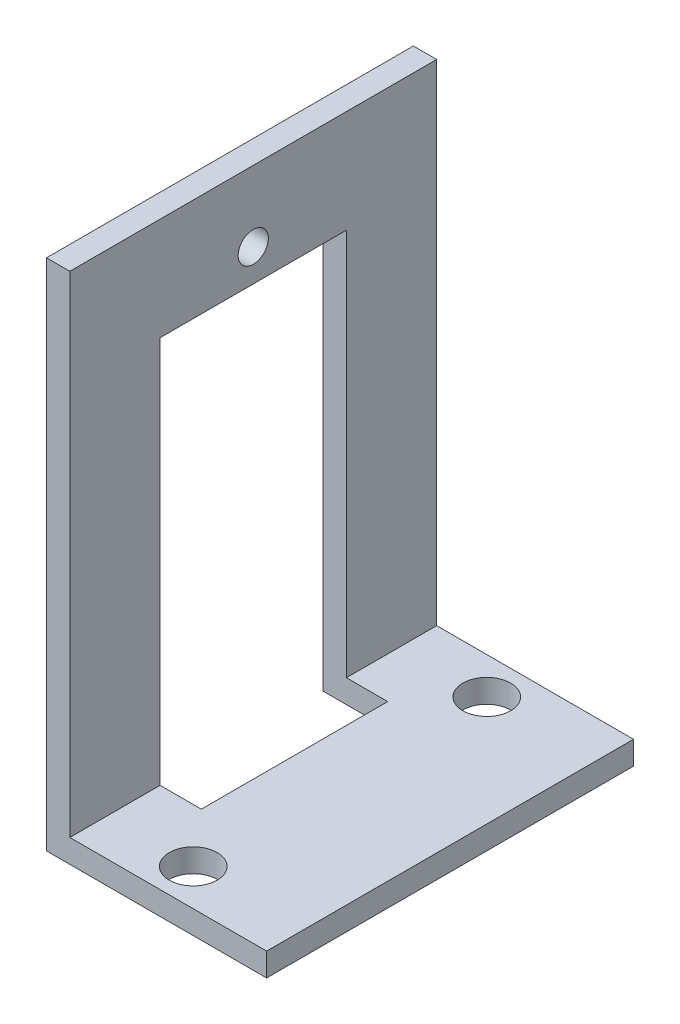
from build123d import *

# Parameters (mm, degrees)
BOSS_EXTRUDE1_DEPTH   = 12.5
F_4_CLEARANCE_HOLE1_D = 3.2639
F_1_CLEARANCE_HOLE1_D = 2.0574
SKETCH7_W             = 12.7
SKETCH7_H             = 28
CUT_EXTRUDE1_DEPTH    = 4.4


with BuildPart() as part:
    # Sketch1 → Boss-Extrude1 (new, symmetric)
    with BuildSketch(Plane.XY):
        Polygon((15, 0), (0, 0), (0, 35), (1.5875, 35), (1.5875, 1.5875), (15, 1.5875), align=None)
    extrude(amount=BOSS_EXTRUDE1_DEPTH, both=True)

    # #4 Clearance Hole1 (through all)
    with Locations(Plane(origin=(0, 0, 0), x_dir=(-1, 0, 0), z_dir=(0, -1, 0))):
        with Locations((-7.5, 10), (-7.5, -10)):
            Hole(F_4_CLEARANCE_HOLE1_D / 2)

    # #1 Clearance Hole1 (through all)
    with Locations(Plane.ZY):
        with Locations((0, 30.19)):
            Hole(F_1_CLEARANCE_HOLE1_D / 2)

    # Sketch7 → Cut-Extrude1 (cut)
    with BuildSketch(Plane.ZY):
        with Locations((0, 14)):
            Rectangle(SKETCH7_W, SKETCH7_H)
    extrude(amount=-CUT_EXTRUDE1_DEPTH, mode=Mode.SUBTRACT)


solid = part.part
